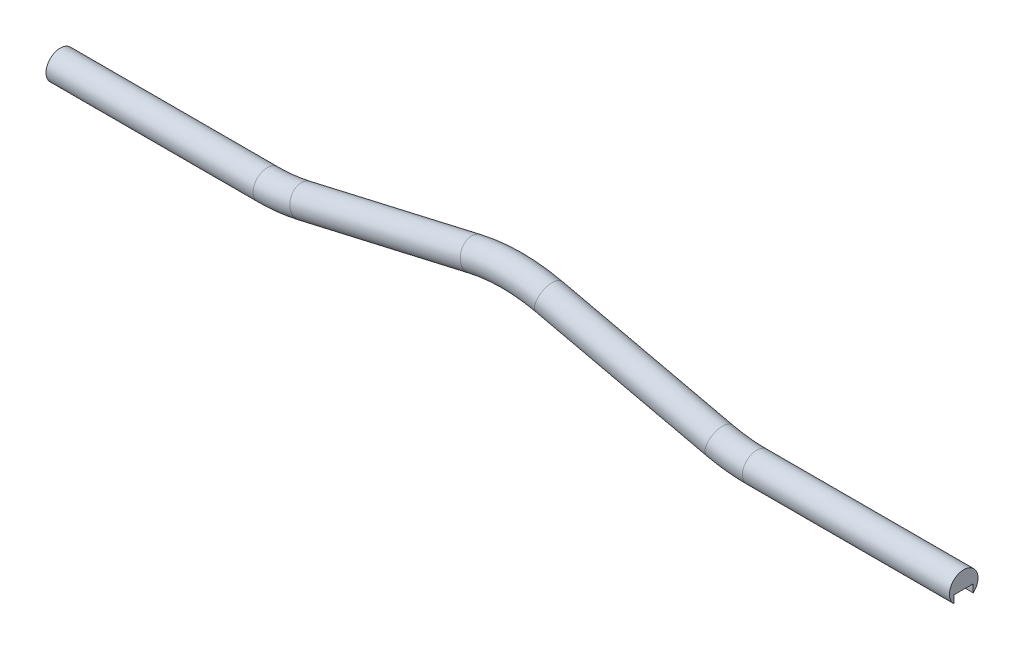
from build123d import *

# Parameters (mm, degrees)
SWEEP1_PROFILE_R   = 15
SKETCH26_W         = 20
SKETCH26_H         = 24.358108154
CUT_EXTRUDE2_DEPTH = 237.5
CUT_EXTRUDE3_START = -950
SKETCH26_2_W       = 20
SKETCH26_2_H       = 24.358108154
CUT_EXTRUDE3_DEPTH = 237.5


with BuildPart() as part:
    # Sweep1: sweep along a path in Sketch1
    with BuildLine(Plane.XY) as sweep1_path:
        Line((-475, 0), (-257.280174441, 0))
        ThreePointArc((-257.280174441, 0), (-237.625861021, 1.110364069), (-218.221667938, 4.42732581))
        Line((-218.221667938, 4.42732581), (-39.058506504, 45.57267419))
        ThreePointArc((-39.058506504, 45.57267419), (0, 50), (39.058506504, 45.57267419))
        Line((39.058506504, 45.57267419), (218.221667938, 4.42732581))
        ThreePointArc((218.221667938, 4.42732581), (237.625861021, 1.110364069), (257.280174441, 0))
        Line((257.280174441, 0), (475, 0))
    # Sweep1 profile (on start of the path) → Sweep1 (sweep)
    with BuildSketch(Plane(origin=(-475, 0, 0), x_dir=(0, 0, 1), z_dir=(1, 0, 0))):
        Circle(SWEEP1_PROFILE_R)
    sweep(path=sweep1_path.line)

    # Sketch26 → Cut-Extrude2 (cut)
    with BuildSketch(Plane.ZY.offset(475)):
        with Locations((0, -15)):
            Rectangle(SKETCH26_W, SKETCH26_H)
    extrude(amount=-CUT_EXTRUDE2_DEPTH, mode=Mode.SUBTRACT)

    # Sketch26<2> → Cut-Extrude3 (cut)
    with BuildSketch(Plane.ZY.offset(475).offset(CUT_EXTRUDE3_START)):
        with Locations((0, -15)):
            Rectangle(SKETCH26_2_W, SKETCH26_2_H)
    extrude(amount=CUT_EXTRUDE3_DEPTH, mode=Mode.SUBTRACT)


solid = part.part
